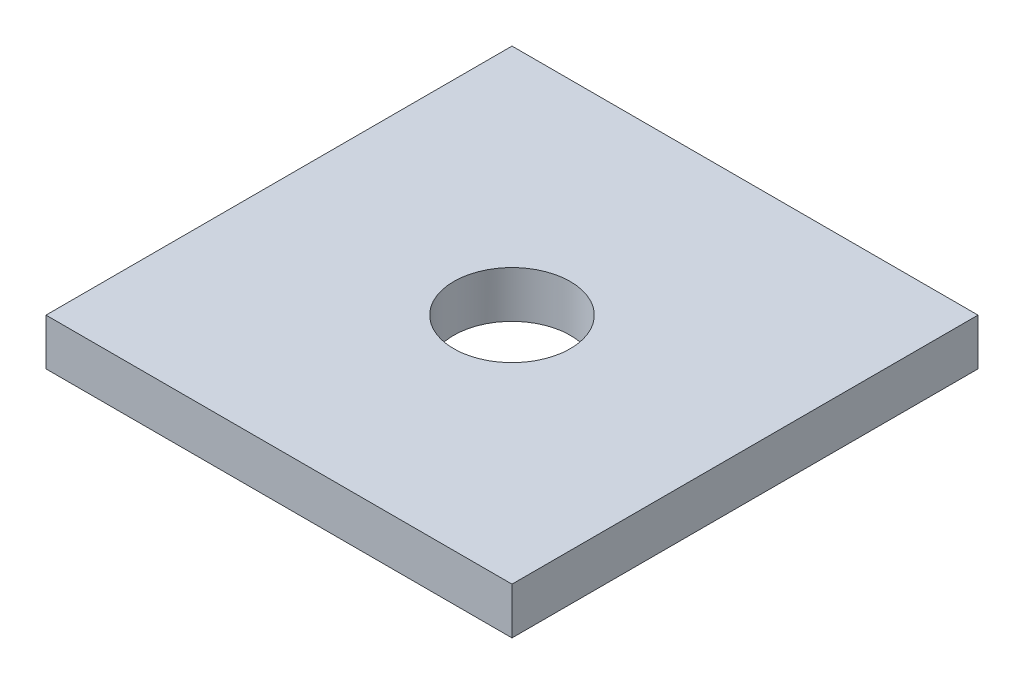
from build123d import *

# Parameters (mm, degrees)
SKETCH1_W           = 40
SKETCH1_H           = 40
BOSS_EXTRUDE1_DEPTH = 4
SKETCH2_R           = 5
CUT_EXTRUDE1_DEPTH  = 10


with BuildPart() as part:
    # Sketch1 → Boss-Extrude1 (new body)
    with BuildSketch(Plane(origin=(0, 0, 0), x_dir=(1, 0, 0), z_dir=(0, 1, 0))):
        Rectangle(SKETCH1_W, SKETCH1_H)
    extrude(amount=BOSS_EXTRUDE1_DEPTH)

    # Sketch2 → Cut-Extrude1 (cut)
    with BuildSketch(Plane.XZ):
        with Locations(Location((0, 0, 0), (0, 0, 270))):
            Circle(SKETCH2_R)
    extrude(amount=-CUT_EXTRUDE1_DEPTH, mode=Mode.SUBTRACT)


solid = part.part
